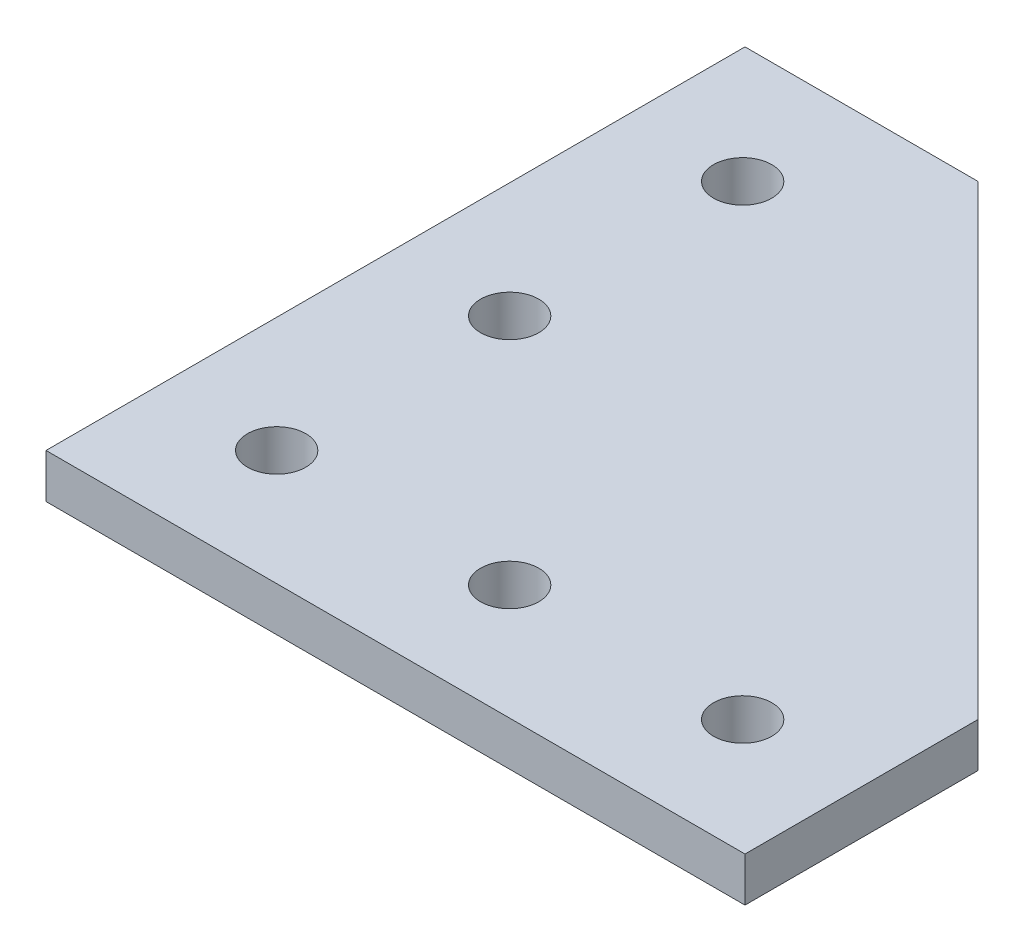
from build123d import *

# Parameters (mm, degrees)
SKETCH1_R           = 3.175
BOSS_EXTRUDE1_DEPTH = 4.826


with BuildPart() as part:
    # Sketch1 → Boss-Extrude1 (new body)
    with BuildSketch(Plane(origin=(0, 0, 0), x_dir=(1, 0, 0), z_dir=(0, 1, 0))):
        Polygon((0, 0), (76.2, 0), (76.2, 25.4), (25.4, 76.2), (0, 76.2), align=None)
        with Locations(Location((12.573, 12.573, 0), (0, 0, 270))):
            Circle(SKETCH1_R, mode=Mode.SUBTRACT)
        with Locations(Location((37.973, 12.573, 0), (0, 0, 270))):
            Circle(SKETCH1_R, mode=Mode.SUBTRACT)
        with Locations(Location((63.373, 12.573, 0), (0, 0, 270))):
            Circle(SKETCH1_R, mode=Mode.SUBTRACT)
        with Locations(Location((12.573, 37.973, 0), (0, 0, 270))):
            Circle(SKETCH1_R, mode=Mode.SUBTRACT)
        with Locations(Location((12.573, 63.373, 0), (0, 0, 270))):
            Circle(SKETCH1_R, mode=Mode.SUBTRACT)
    extrude(amount=BOSS_EXTRUDE1_DEPTH)


solid = part.part
